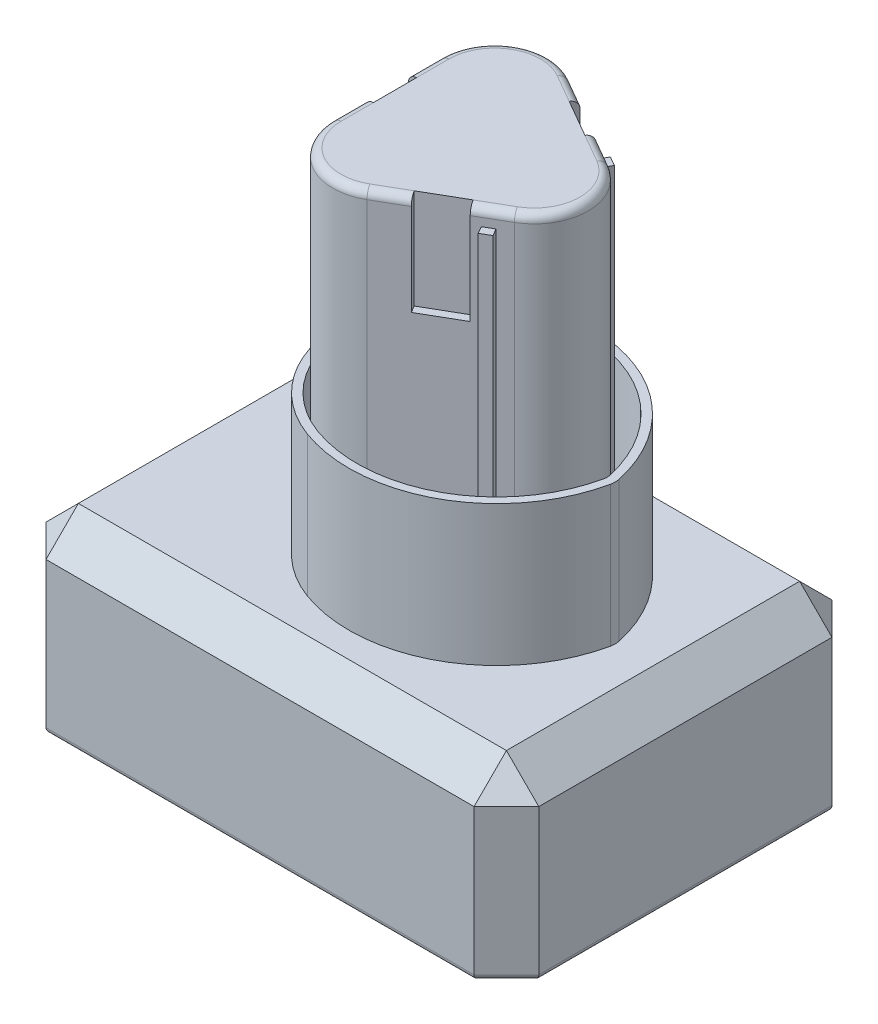
from build123d import *

# Parameters (mm, degrees)
SKETCH1_W           = 91.35
SKETCH1_H           = 66.35
BOSS_EXTRUDE1_DEPTH = 34
CHAMFER1_SIZE       = 6
SKETCH2_R           = 3
SKETCH2_R_2         = 1.5
CUT_EXTRUDE1_DEPTH  = 6
SKETCH2_3_R         = 1.5
CUT_EXTRUDE2_DEPTH  = 12
FILLET1_R           = 1
BOSS_EXTRUDE3_START = 34
BOSS_EXTRUDE3_DEPTH = 68.5
CUT_EXTRUDE3_START  = 84
SKETCH1_6_W         = 1.5
SKETCH1_6_H         = 8
CUT_EXTRUDE3_DEPTH  = 18.5
BOSS_EXTRUDE4_START = 34
BOSS_EXTRUDE4_DEPTH = 65.5
FILLET2_R           = 1.5
BOSS_EXTRUDE6_START = 34
BOSS_EXTRUDE6_DEPTH = 26


with BuildPart() as part:
    # Sketch1 → Boss-Extrude1 (new body)
    with BuildSketch(Plane(origin=(0, 0, 0), x_dir=(1, 0, 0), z_dir=(0, 1, 0))):
        with Locations((45.675, 33.175)):
            Rectangle(SKETCH1_W, SKETCH1_H)
    extrude(amount=BOSS_EXTRUDE1_DEPTH)

    # Chamfer1
    chamfer1_edges = [part.edges().sort_by_distance(p)[0] for p in [
        (91.35, 34, -33.175),
        (45.675, 34, 0),
        (0, 34, -33.175),
        (0, 17, 0),
        (91.35, 17, 0),
        (91.35, 17, -66.35),
        (0, 17, -66.35),
        (45.675, 34, -66.35),
    ]]
    chamfer(chamfer1_edges, length=CHAMFER1_SIZE)

    # Sketch2 → Cut-Extrude1 (cut)
    # profile 1 of 4: a face of its own
    with BuildSketch(Plane(origin=(0, 0, 0), x_dir=(-1, 0, 0), z_dir=(0, -1, 0))):
        with Locations(Location((-7.175, 11.175, 0), (0, 0, 90))):
            Circle(SKETCH2_R)
        with Locations(Location((-7.175, 11.175, 0), (0, 0, 90))):
            Circle(SKETCH2_R_2, mode=Mode.SUBTRACT)
    # profile 2 of 4: a face of its own
    with BuildSketch(Plane(origin=(0, 0, 0), x_dir=(-1, 0, 0), z_dir=(0, -1, 0))):
        with Locations(Location((-84.175, 11.175, 0), (0, 0, 90))):
            Circle(SKETCH2_R)
        with Locations(Location((-84.175, 11.175, 0), (0, 0, 90))):
            Circle(SKETCH2_R_2, mode=Mode.SUBTRACT)
    # profile 3 of 4: a face of its own
    with BuildSketch(Plane(origin=(0, 0, 0), x_dir=(-1, 0, 0), z_dir=(0, -1, 0))):
        with Locations(Location((-7.175, 55.175, 0), (0, 0, 90))):
            Circle(SKETCH2_R)
        with Locations(Location((-7.175, 55.175, 0), (0, 0, 90))):
            Circle(SKETCH2_R_2, mode=Mode.SUBTRACT)
    # profile 4 of 4: a face of its own
    with BuildSketch(Plane(origin=(0, 0, 0), x_dir=(-1, 0, 0), z_dir=(0, -1, 0))):
        with Locations(Location((-84.175, 55.175, 0), (0, 0, 90))):
            Circle(SKETCH2_R)
        with Locations(Location((-84.175, 55.175, 0), (0, 0, 90))):
            Circle(SKETCH2_R_2, mode=Mode.SUBTRACT)
    extrude(amount=-CUT_EXTRUDE1_DEPTH, mode=Mode.SUBTRACT)

    # Sketch2<3> → Cut-Extrude2 (cut)
    with BuildSketch(Plane(origin=(0, 0, 0), x_dir=(-1, 0, 0), z_dir=(0, -1, 0))):
        with Locations(Location((-7.175, 11.175, 0), (0, 0, 90))):
            Circle(SKETCH2_3_R)
        with Locations(Location((-84.175, 11.175, 0), (0, 0, 90))):
            Circle(SKETCH2_3_R)
        with Locations(Location((-84.175, 55.175, 0), (0, 0, 90))):
            Circle(SKETCH2_3_R)
        with Locations(Location((-7.175, 55.175, 0), (0, 0, 90))):
            Circle(SKETCH2_3_R)
    extrude(amount=-CUT_EXTRUDE2_DEPTH, mode=Mode.SUBTRACT)

    # Fillet1
    fillet1_edges = [part.edges().sort_by_distance(p)[0] for p in [
        (45.675, 0, -66.35),
        (0, 0, -33.175),
        (91.35, 0, -33.175),
        (45.675, 0, 0),
        (3, 0, -3),
        (3, 0, -63.35),
        (88.35, 0, -3),
        (88.35, 0, -63.35),
    ]]
    fillet(fillet1_edges, radius=FILLET1_R)

    # Sketch1<5> → Boss-Extrude3 (add)
    with BuildSketch(Plane(origin=(0, 0, 0), x_dir=(1, 0, 0), z_dir=(0, 1, 0)).offset(BOSS_EXTRUDE3_START)):
        with BuildLine():
            Line((36, 43.175), (36, 23.175))
            ThreePointArc((36, 23.175), (41, 14.514745962), (51, 14.514745962))
            Line((51, 14.514745962), (68.320508076, 24.514745962))
            ThreePointArc((68.320508076, 24.514745962), (73.320508076, 33.175), (68.320508076, 41.835254038))
            Line((68.320508076, 41.835254038), (51, 51.835254038))
            ThreePointArc((51, 51.835254038), (41, 51.835254038), (36, 43.175))
        make_face()
    extrude(amount=BOSS_EXTRUDE3_DEPTH)

    # Sketch1<6> → Cut-Extrude3 (cut)
    with BuildSketch(Plane(origin=(0, 0, 0), x_dir=(1, 0, 0), z_dir=(0, 1, 0)).offset(CUT_EXTRUDE3_START)):
        Polygon((63.124355653, 44.835254038), (56.196152423, 48.835254038), (55.446152423, 47.536215932), (62.374355653, 43.536215932), align=None)
        Polygon((55.446152423, 18.813784068), (56.196152423, 17.514745962), (63.124355653, 21.514745962), (62.374355653, 22.813784068), align=None)
        with Locations((36.75, 33.175)):
            Rectangle(SKETCH1_6_W, SKETCH1_6_H)
    extrude(amount=CUT_EXTRUDE3_DEPTH, mode=Mode.SUBTRACT)

    # Sketch1<7> → Boss-Extrude4 (add)
    with BuildSketch(Plane(origin=(0, 0, 0), x_dir=(1, 0, 0), z_dir=(0, 1, 0)).offset(BOSS_EXTRUDE4_START)):
        Polygon((65.198393759, 45.427593414), (64.423393759, 44.085254038), (66.155444566, 43.085254038), (66.930444566, 44.427593414), align=None)
        Polygon((66.155444566, 23.264745962), (64.423393759, 22.264745962), (65.198393759, 20.922406586), (66.930444566, 21.922406586), align=None)
    extrude(amount=BOSS_EXTRUDE4_DEPTH)

    # Fillet2
    fillet2_edges = [part.edges().sort_by_distance(p)[0] for p in [
        (53.598076211, 102.5, -16.014745962),
        (36, 102.5, -26.175),
        (36, 102.5, -40.175),
        (53.598076211, 102.5, -50.335254038),
        (65.722431864, 102.5, -43.335254038),
        (65.722431864, 102.5, -23.014745962),
        (41, 102.5, -14.514745962),
        (41, 102.5, -51.835254038),
        (73.320508076, 102.5, -33.175),
    ]]
    fillet(fillet2_edges, radius=FILLET2_R)


with BuildPart() as body_2:
    # Sketch1<8> → Boss-Extrude6 (new body)
    with BuildSketch(Plane(origin=(0, 0, 0), x_dir=(1, 0, 0), z_dir=(0, 1, 0)).offset(BOSS_EXTRUDE6_START)):
        with BuildLine():
            ThreePointArc((42.063758389, 53.980369128), (64.703364915, 52.213077053), (78.235525618, 33.976966404))
            ThreePointArc((78.235525618, 33.976966404), (78.320508076, 33.175), (78.235525618, 32.373033596))
            ThreePointArc((78.235525618, 32.373033596), (64.703364915, 14.136922947), (42.063758389, 12.369630872))
            ThreePointArc((42.063758389, 12.369630872), (27.5, 33.175), (42.063758389, 53.980369128))
        make_face()
        with BuildLine():
            ThreePointArc((42.577181208, 52.570973154), (63.977453762, 50.900425919), (76.768838937, 33.662593726))
            ThreePointArc((76.768838937, 33.662593726), (76.820508076, 33.175), (76.768838937, 32.687406274))
            ThreePointArc((76.768838937, 32.687406274), (63.977453762, 15.449574081), (42.577181208, 13.779026846))
            ThreePointArc((42.577181208, 13.779026846), (29, 33.175), (42.577181208, 52.570973154))
        make_face(mode=Mode.SUBTRACT)
    extrude(amount=BOSS_EXTRUDE6_DEPTH)


solid = Compound([part.part, body_2.part])
